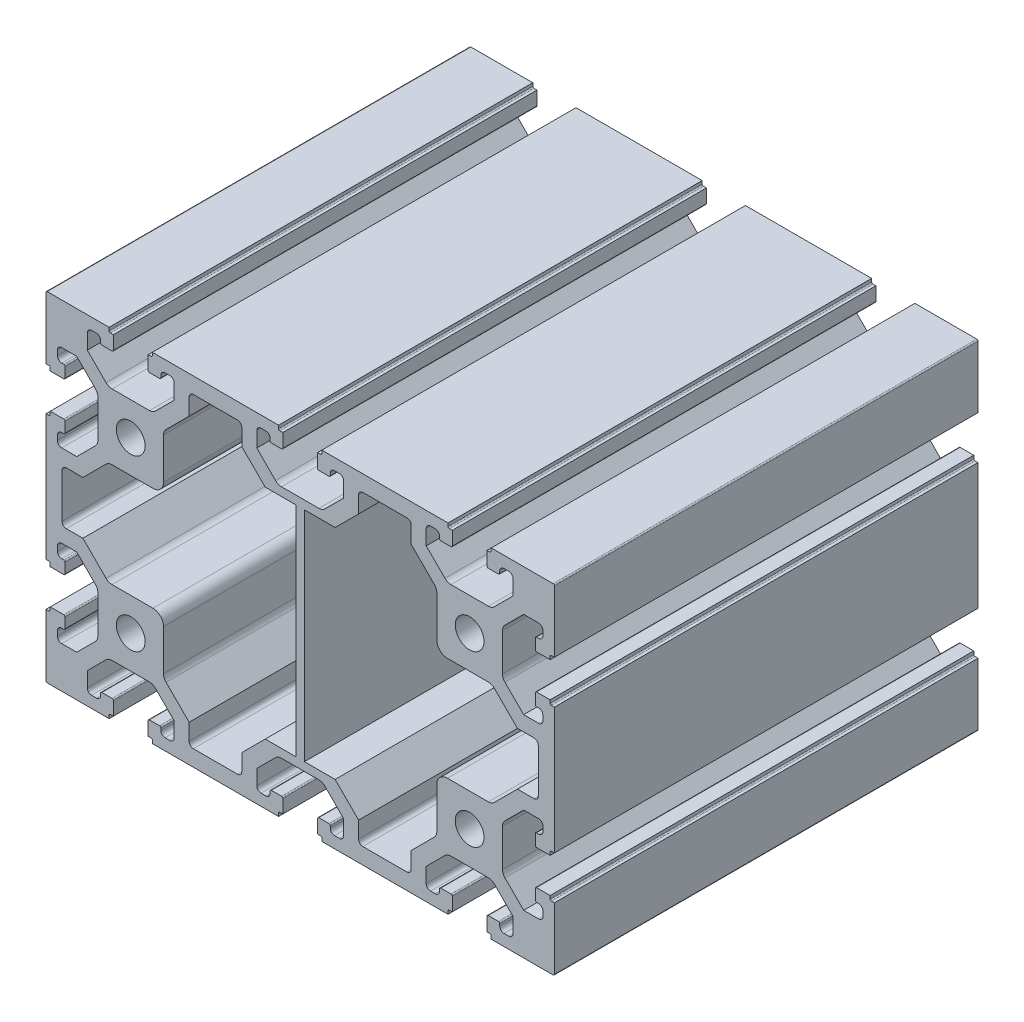
from build123d import *

# Parameters (mm, degrees)
SKETCH_1_R      = 3.4
EXTRUDE_1_DEPTH = 100


with BuildPart() as part:
    # 草图1 → 凸台-拉伸1 (new body)
    with BuildSketch(Plane.XY):
        with BuildLine():
            Line((-45.78942527, 39.655287365), (-60.38942527, 39.655287365))
            ThreePointArc((-60.38942527, 39.655287365), (-60.601557304, 39.567419399), (-60.68942527, 39.355287365))
            Line((-60.68942527, 39.355287365), (-60.68942527, 24.755287365))
            Line((-60.68942527, 24.755287365), (-59.98942527, 24.755287365))
            ThreePointArc((-59.98942527, 24.755287365), (-59.777293236, 24.667419399), (-59.68942527, 24.455287365))
            Line((-59.68942527, 24.455287365), (-59.68942527, 23.755287365))
            Line((-59.68942527, 23.755287365), (-56.48942527, 23.755287365))
            ThreePointArc((-56.48942527, 23.755287365), (-56.277293236, 23.843155331), (-56.18942527, 24.055287365))
            Line((-56.18942527, 24.055287365), (-56.18942527, 26.455287365))
            ThreePointArc((-56.18942527, 26.455287365), (-56.277293236, 26.667419399), (-56.48942527, 26.755287365))
            Line((-56.48942527, 26.755287365), (-56.98942527, 26.755287365))
            ThreePointArc((-56.98942527, 26.755287365), (-57.696532051, 27.048180584), (-57.98942527, 27.755287365))
            Line((-57.98942527, 27.755287365), (-57.98942527, 28.905287365))
            ThreePointArc((-57.98942527, 28.905287365), (-57.696532051, 29.612394146), (-56.98942527, 29.905287365))
            Line((-56.98942527, 29.905287365), (-53.442583275, 29.905287365))
            Line((-53.442583275, 29.905287365), (-49.025211708, 25.487915797))
            ThreePointArc((-49.025211708, 25.487915797), (-48.591666205, 24.8390691), (-48.43942527, 24.073702235))
            Line((-48.43942527, 24.073702235), (-48.43942527, 15.236872495))
            ThreePointArc((-48.43942527, 15.236872495), (-48.591666205, 14.47150563), (-49.025211708, 13.822658933))
            Line((-49.025211708, 13.822658933), (-53.442583275, 9.405287365))
            Line((-53.442583275, 9.405287365), (-56.98942527, 9.405287365))
            ThreePointArc((-56.98942527, 9.405287365), (-57.696532051, 9.698180584), (-57.98942527, 10.405287365))
            Line((-57.98942527, 10.405287365), (-57.98942527, 11.555287365))
            ThreePointArc((-57.98942527, 11.555287365), (-57.696532051, 12.262394146), (-56.98942527, 12.555287365))
            Line((-56.98942527, 12.555287365), (-56.48942527, 12.555287365))
            ThreePointArc((-56.48942527, 12.555287365), (-56.277293236, 12.643155331), (-56.18942527, 12.855287365))
            Line((-56.18942527, 12.855287365), (-56.18942527, 15.255287365))
            ThreePointArc((-56.18942527, 15.255287365), (-56.277293236, 15.467419399), (-56.48942527, 15.555287365))
            Line((-56.48942527, 15.555287365), (-59.68942527, 15.555287365))
            Line((-59.68942527, 15.555287365), (-59.68942527, 14.855287365))
            ThreePointArc((-59.68942527, 14.855287365), (-59.777293236, 14.643155331), (-59.98942527, 14.555287365))
            Line((-59.98942527, 14.555287365), (-60.68942527, 14.555287365))
            Line((-60.68942527, 14.555287365), (-60.68942527, 4.155287365))
            Line((-60.68942527, 4.155287365), (-60.68942527, -4.844712635))
            Line((-60.68942527, -4.844712635), (-60.68942527, -15.244712635))
            Line((-60.68942527, -15.244712635), (-59.98942527, -15.244712635))
            ThreePointArc((-59.98942527, -15.244712635), (-59.777293236, -15.332580601), (-59.68942527, -15.544712635))
            Line((-59.68942527, -15.544712635), (-59.68942527, -16.244712635))
            Line((-59.68942527, -16.244712635), (-56.48942527, -16.244712635))
            ThreePointArc((-56.48942527, -16.244712635), (-56.277293236, -16.156844669), (-56.18942527, -15.944712635))
            Line((-56.18942527, -15.944712635), (-56.18942527, -13.544712635))
            ThreePointArc((-56.18942527, -13.544712635), (-56.277293236, -13.332580601), (-56.48942527, -13.244712635))
            Line((-56.48942527, -13.244712635), (-56.98942527, -13.244712635))
            ThreePointArc((-56.98942527, -13.244712635), (-57.696532051, -12.951819416), (-57.98942527, -12.244712635))
            Line((-57.98942527, -12.244712635), (-57.98942527, -11.094712635))
            ThreePointArc((-57.98942527, -11.094712635), (-57.696532051, -10.387605854), (-56.98942527, -10.094712635))
            Line((-56.98942527, -10.094712635), (-53.442583275, -10.094712635))
            Line((-53.442583275, -10.094712635), (-49.025211708, -14.512084203))
            ThreePointArc((-49.025211708, -14.512084203), (-48.591666205, -15.1609309), (-48.43942527, -15.926297765))
            Line((-48.43942527, -15.926297765), (-48.43942527, -24.763127505))
            ThreePointArc((-48.43942527, -24.763127505), (-48.591666205, -25.52849437), (-49.025211708, -26.177341067))
            Line((-49.025211708, -26.177341067), (-53.442583275, -30.594712635))
            Line((-53.442583275, -30.594712635), (-56.98942527, -30.594712635))
            ThreePointArc((-56.98942527, -30.594712635), (-57.696532051, -30.301819416), (-57.98942527, -29.594712635))
            Line((-57.98942527, -29.594712635), (-57.98942527, -28.444712635))
            ThreePointArc((-57.98942527, -28.444712635), (-57.696532051, -27.737605854), (-56.98942527, -27.444712635))
            Line((-56.98942527, -27.444712635), (-56.48942527, -27.444712635))
            ThreePointArc((-56.48942527, -27.444712635), (-56.277293236, -27.356844669), (-56.18942527, -27.144712635))
            Line((-56.18942527, -27.144712635), (-56.18942527, -24.744712635))
            ThreePointArc((-56.18942527, -24.744712635), (-56.277293236, -24.532580601), (-56.48942527, -24.444712635))
            Line((-56.48942527, -24.444712635), (-59.68942527, -24.444712635))
            Line((-59.68942527, -24.444712635), (-59.68942527, -25.144712635))
            ThreePointArc((-59.68942527, -25.144712635), (-59.777293236, -25.356844669), (-59.98942527, -25.444712635))
            Line((-59.98942527, -25.444712635), (-60.68942527, -25.444712635))
            Line((-60.68942527, -25.444712635), (-60.68942527, -40.044712635))
            ThreePointArc((-60.68942527, -40.044712635), (-60.601557304, -40.256844669), (-60.38942527, -40.344712635))
            Line((-60.38942527, -40.344712635), (-45.78942527, -40.344712635))
            Line((-45.78942527, -40.344712635), (-45.78942527, -39.644712635))
            ThreePointArc((-45.78942527, -39.644712635), (-45.701557304, -39.432580601), (-45.48942527, -39.344712635))
            Line((-45.48942527, -39.344712635), (-44.78942527, -39.344712635))
            Line((-44.78942527, -39.344712635), (-44.78942527, -36.144712635))
            ThreePointArc((-44.78942527, -36.144712635), (-44.877293236, -35.932580601), (-45.08942527, -35.844712635))
            Line((-45.08942527, -35.844712635), (-47.48942527, -35.844712635))
            ThreePointArc((-47.48942527, -35.844712635), (-47.701557304, -35.932580601), (-47.78942527, -36.144712635))
            Line((-47.78942527, -36.144712635), (-47.78942527, -36.644712635))
            ThreePointArc((-47.78942527, -36.644712635), (-48.082318489, -37.351819416), (-48.78942527, -37.644712635))
            Line((-48.78942527, -37.644712635), (-49.93942527, -37.644712635))
            ThreePointArc((-49.93942527, -37.644712635), (-50.646532051, -37.351819416), (-50.93942527, -36.644712635))
            Line((-50.93942527, -36.644712635), (-50.93942527, -33.09787064))
            Line((-50.93942527, -33.09787064), (-46.522053702, -28.680499073))
            ThreePointArc((-46.522053702, -28.680499073), (-45.873207005, -28.24695357), (-45.10784014, -28.094712635))
            Line((-45.10784014, -28.094712635), (-36.2710104, -28.094712635))
            ThreePointArc((-36.2710104, -28.094712635), (-35.505643535, -28.24695357), (-34.856796838, -28.680499073))
            Line((-34.856796838, -28.680499073), (-30.43942527, -33.09787064))
            Line((-30.43942527, -33.09787064), (-30.43942527, -36.644712635))
            ThreePointArc((-30.43942527, -36.644712635), (-30.732318489, -37.351819416), (-31.43942527, -37.644712635))
            Line((-31.43942527, -37.644712635), (-32.58942527, -37.644712635))
            ThreePointArc((-32.58942527, -37.644712635), (-33.296532051, -37.351819416), (-33.58942527, -36.644712635))
            Line((-33.58942527, -36.644712635), (-33.58942527, -36.144712635))
            ThreePointArc((-33.58942527, -36.144712635), (-33.677293236, -35.932580601), (-33.88942527, -35.844712635))
            Line((-33.88942527, -35.844712635), (-36.28942527, -35.844712635))
            ThreePointArc((-36.28942527, -35.844712635), (-36.501557304, -35.932580601), (-36.58942527, -36.144712635))
            Line((-36.58942527, -36.144712635), (-36.58942527, -39.344712635))
            Line((-36.58942527, -39.344712635), (-35.88942527, -39.344712635))
            ThreePointArc((-35.88942527, -39.344712635), (-35.677293236, -39.432580601), (-35.58942527, -39.644712635))
            Line((-35.58942527, -39.644712635), (-35.58942527, -40.344712635))
            Line((-35.58942527, -40.344712635), (-25.18942527, -40.344712635))
            Line((-25.18942527, -40.344712635), (-16.18942527, -40.344712635))
            Line((-16.18942527, -40.344712635), (-5.78942527, -40.344712635))
            Line((-5.78942527, -40.344712635), (-5.78942527, -39.644712635))
            ThreePointArc((-5.78942527, -39.644712635), (-5.701557304, -39.432580601), (-5.48942527, -39.344712635))
            Line((-5.48942527, -39.344712635), (-4.78942527, -39.344712635))
            Line((-4.78942527, -39.344712635), (-4.78942527, -36.144712635))
            ThreePointArc((-4.78942527, -36.144712635), (-4.877293236, -35.932580601), (-5.08942527, -35.844712635))
            Line((-5.08942527, -35.844712635), (-7.48942527, -35.844712635))
            ThreePointArc((-7.48942527, -35.844712635), (-7.701557304, -35.932580601), (-7.78942527, -36.144712635))
            Line((-7.78942527, -36.144712635), (-7.78942527, -36.644712635))
            ThreePointArc((-7.78942527, -36.644712635), (-8.082318489, -37.351819416), (-8.78942527, -37.644712635))
            Line((-8.78942527, -37.644712635), (-9.93942527, -37.644712635))
            ThreePointArc((-9.93942527, -37.644712635), (-10.646532051, -37.351819416), (-10.93942527, -36.644712635))
            Line((-10.93942527, -36.644712635), (-10.93942527, -33.09787064))
            Line((-10.93942527, -33.09787064), (-6.522053702, -28.680499073))
            ThreePointArc((-6.522053702, -28.680499073), (-5.873207005, -28.24695357), (-5.10784014, -28.094712635))
            Line((-5.10784014, -28.094712635), (-0.68942527, -28.094712635))
            Line((-0.68942527, -28.094712635), (3.7289896, -28.094712635))
            ThreePointArc((3.7289896, -28.094712635), (4.494356465, -28.24695357), (5.143203162, -28.680499073))
            Line((5.143203162, -28.680499073), (9.56057473, -33.09787064))
            Line((9.56057473, -33.09787064), (9.56057473, -36.644712635))
            ThreePointArc((9.56057473, -36.644712635), (9.267681511, -37.351819416), (8.56057473, -37.644712635))
            Line((8.56057473, -37.644712635), (7.41057473, -37.644712635))
            ThreePointArc((7.41057473, -37.644712635), (6.703467949, -37.351819416), (6.41057473, -36.644712635))
            Line((6.41057473, -36.644712635), (6.41057473, -36.144712635))
            ThreePointArc((6.41057473, -36.144712635), (6.322706764, -35.932580601), (6.11057473, -35.844712635))
            Line((6.11057473, -35.844712635), (3.71057473, -35.844712635))
            ThreePointArc((3.71057473, -35.844712635), (3.498442696, -35.932580601), (3.41057473, -36.144712635))
            Line((3.41057473, -36.144712635), (3.41057473, -39.344712635))
            Line((3.41057473, -39.344712635), (4.11057473, -39.344712635))
            ThreePointArc((4.11057473, -39.344712635), (4.322706764, -39.432580601), (4.41057473, -39.644712635))
            Line((4.41057473, -39.644712635), (4.41057473, -40.344712635))
            Line((4.41057473, -40.344712635), (14.81057473, -40.344712635))
            Line((14.81057473, -40.344712635), (23.81057473, -40.344712635))
            Line((23.81057473, -40.344712635), (34.21057473, -40.344712635))
            Line((34.21057473, -40.344712635), (34.21057473, -39.644712635))
            ThreePointArc((34.21057473, -39.644712635), (34.298442696, -39.432580601), (34.51057473, -39.344712635))
            Line((34.51057473, -39.344712635), (35.21057473, -39.344712635))
            Line((35.21057473, -39.344712635), (35.21057473, -36.144712635))
            ThreePointArc((35.21057473, -36.144712635), (35.122706764, -35.932580601), (34.91057473, -35.844712635))
            Line((34.91057473, -35.844712635), (32.51057473, -35.844712635))
            ThreePointArc((32.51057473, -35.844712635), (32.298442696, -35.932580601), (32.21057473, -36.144712635))
            Line((32.21057473, -36.144712635), (32.21057473, -36.644712635))
            ThreePointArc((32.21057473, -36.644712635), (31.917681511, -37.351819416), (31.21057473, -37.644712635))
            Line((31.21057473, -37.644712635), (30.06057473, -37.644712635))
            ThreePointArc((30.06057473, -37.644712635), (29.353467949, -37.351819416), (29.06057473, -36.644712635))
            Line((29.06057473, -36.644712635), (29.06057473, -33.09787064))
            Line((29.06057473, -33.09787064), (33.477946298, -28.680499073))
            ThreePointArc((33.477946298, -28.680499073), (34.126792995, -28.24695357), (34.89215986, -28.094712635))
            Line((34.89215986, -28.094712635), (43.7289896, -28.094712635))
            ThreePointArc((43.7289896, -28.094712635), (44.494356465, -28.24695357), (45.143203162, -28.680499073))
            Line((45.143203162, -28.680499073), (49.56057473, -33.09787064))
            Line((49.56057473, -33.09787064), (49.56057473, -36.644712635))
            ThreePointArc((49.56057473, -36.644712635), (49.267681511, -37.351819416), (48.56057473, -37.644712635))
            Line((48.56057473, -37.644712635), (47.41057473, -37.644712635))
            ThreePointArc((47.41057473, -37.644712635), (46.703467949, -37.351819416), (46.41057473, -36.644712635))
            Line((46.41057473, -36.644712635), (46.41057473, -36.144712635))
            ThreePointArc((46.41057473, -36.144712635), (46.322706764, -35.932580601), (46.11057473, -35.844712635))
            Line((46.11057473, -35.844712635), (43.71057473, -35.844712635))
            ThreePointArc((43.71057473, -35.844712635), (43.498442696, -35.932580601), (43.41057473, -36.144712635))
            Line((43.41057473, -36.144712635), (43.41057473, -39.344712635))
            Line((43.41057473, -39.344712635), (44.11057473, -39.344712635))
            ThreePointArc((44.11057473, -39.344712635), (44.322706764, -39.432580601), (44.41057473, -39.644712635))
            Line((44.41057473, -39.644712635), (44.41057473, -40.344712635))
            Line((44.41057473, -40.344712635), (59.01057473, -40.344712635))
            ThreePointArc((59.01057473, -40.344712635), (59.222706764, -40.256844669), (59.31057473, -40.044712635))
            Line((59.31057473, -40.044712635), (59.31057473, -25.444712635))
            Line((59.31057473, -25.444712635), (58.61057473, -25.444712635))
            ThreePointArc((58.61057473, -25.444712635), (58.398442696, -25.356844669), (58.31057473, -25.144712635))
            Line((58.31057473, -25.144712635), (58.31057473, -24.444712635))
            Line((58.31057473, -24.444712635), (55.11057473, -24.444712635))
            ThreePointArc((55.11057473, -24.444712635), (54.898442696, -24.532580601), (54.81057473, -24.744712635))
            Line((54.81057473, -24.744712635), (54.81057473, -27.144712635))
            ThreePointArc((54.81057473, -27.144712635), (54.898442696, -27.356844669), (55.11057473, -27.444712635))
            Line((55.11057473, -27.444712635), (55.61057473, -27.444712635))
            ThreePointArc((55.61057473, -27.444712635), (56.317681511, -27.737605854), (56.61057473, -28.444712635))
            Line((56.61057473, -28.444712635), (56.61057473, -29.594712635))
            ThreePointArc((56.61057473, -29.594712635), (56.317681511, -30.301819416), (55.61057473, -30.594712635))
            Line((55.61057473, -30.594712635), (52.063732735, -30.594712635))
            Line((52.063732735, -30.594712635), (47.646361168, -26.177341067))
            ThreePointArc((47.646361168, -26.177341067), (47.212815665, -25.52849437), (47.06057473, -24.763127505))
            Line((47.06057473, -24.763127505), (47.06057473, -15.926297765))
            ThreePointArc((47.06057473, -15.926297765), (47.212815665, -15.1609309), (47.646361168, -14.512084203))
            Line((47.646361168, -14.512084203), (52.063732735, -10.094712635))
            Line((52.063732735, -10.094712635), (55.61057473, -10.094712635))
            ThreePointArc((55.61057473, -10.094712635), (56.317681511, -10.387605854), (56.61057473, -11.094712635))
            Line((56.61057473, -11.094712635), (56.61057473, -12.244712635))
            ThreePointArc((56.61057473, -12.244712635), (56.317681511, -12.951819416), (55.61057473, -13.244712635))
            Line((55.61057473, -13.244712635), (55.11057473, -13.244712635))
            ThreePointArc((55.11057473, -13.244712635), (54.898442696, -13.332580601), (54.81057473, -13.544712635))
            Line((54.81057473, -13.544712635), (54.81057473, -15.944712635))
            ThreePointArc((54.81057473, -15.944712635), (54.898442696, -16.156844669), (55.11057473, -16.244712635))
            Line((55.11057473, -16.244712635), (58.31057473, -16.244712635))
            Line((58.31057473, -16.244712635), (58.31057473, -15.544712635))
            ThreePointArc((58.31057473, -15.544712635), (58.398442696, -15.332580601), (58.61057473, -15.244712635))
            Line((58.61057473, -15.244712635), (59.31057473, -15.244712635))
            Line((59.31057473, -15.244712635), (59.31057473, -4.844712635))
            Line((59.31057473, -4.844712635), (59.31057473, 4.155287365))
            Line((59.31057473, 4.155287365), (59.31057473, 14.555287365))
            Line((59.31057473, 14.555287365), (58.61057473, 14.555287365))
            ThreePointArc((58.61057473, 14.555287365), (58.398442696, 14.643155331), (58.31057473, 14.855287365))
            Line((58.31057473, 14.855287365), (58.31057473, 15.555287365))
            Line((58.31057473, 15.555287365), (55.11057473, 15.555287365))
            ThreePointArc((55.11057473, 15.555287365), (54.898442696, 15.467419399), (54.81057473, 15.255287365))
            Line((54.81057473, 15.255287365), (54.81057473, 12.855287365))
            ThreePointArc((54.81057473, 12.855287365), (54.898442696, 12.643155331), (55.11057473, 12.555287365))
            Line((55.11057473, 12.555287365), (55.61057473, 12.555287365))
            ThreePointArc((55.61057473, 12.555287365), (56.317681511, 12.262394146), (56.61057473, 11.555287365))
            Line((56.61057473, 11.555287365), (56.61057473, 10.405287365))
            ThreePointArc((56.61057473, 10.405287365), (56.317681511, 9.698180584), (55.61057473, 9.405287365))
            Line((55.61057473, 9.405287365), (52.063732735, 9.405287365))
            Line((52.063732735, 9.405287365), (47.646361168, 13.822658933))
            ThreePointArc((47.646361168, 13.822658933), (47.212815665, 14.47150563), (47.06057473, 15.236872495))
            Line((47.06057473, 15.236872495), (47.06057473, 24.073702235))
            ThreePointArc((47.06057473, 24.073702235), (47.212815665, 24.8390691), (47.646361168, 25.487915797))
            Line((47.646361168, 25.487915797), (52.063732735, 29.905287365))
            Line((52.063732735, 29.905287365), (55.61057473, 29.905287365))
            ThreePointArc((55.61057473, 29.905287365), (56.317681511, 29.612394146), (56.61057473, 28.905287365))
            Line((56.61057473, 28.905287365), (56.61057473, 27.755287365))
            ThreePointArc((56.61057473, 27.755287365), (56.317681511, 27.048180584), (55.61057473, 26.755287365))
            Line((55.61057473, 26.755287365), (55.11057473, 26.755287365))
            ThreePointArc((55.11057473, 26.755287365), (54.898442696, 26.667419399), (54.81057473, 26.455287365))
            Line((54.81057473, 26.455287365), (54.81057473, 24.055287365))
            ThreePointArc((54.81057473, 24.055287365), (54.898442696, 23.843155331), (55.11057473, 23.755287365))
            Line((55.11057473, 23.755287365), (58.31057473, 23.755287365))
            Line((58.31057473, 23.755287365), (58.31057473, 24.455287365))
            ThreePointArc((58.31057473, 24.455287365), (58.398442696, 24.667419399), (58.61057473, 24.755287365))
            Line((58.61057473, 24.755287365), (59.31057473, 24.755287365))
            Line((59.31057473, 24.755287365), (59.31057473, 39.355287365))
            ThreePointArc((59.31057473, 39.355287365), (59.222706764, 39.567419399), (59.01057473, 39.655287365))
            Line((59.01057473, 39.655287365), (44.41057473, 39.655287365))
            Line((44.41057473, 39.655287365), (44.41057473, 38.955287365))
            ThreePointArc((44.41057473, 38.955287365), (44.322706764, 38.743155331), (44.11057473, 38.655287365))
            Line((44.11057473, 38.655287365), (43.41057473, 38.655287365))
            Line((43.41057473, 38.655287365), (43.41057473, 35.455287365))
            ThreePointArc((43.41057473, 35.455287365), (43.498442696, 35.243155331), (43.71057473, 35.155287365))
            Line((43.71057473, 35.155287365), (46.11057473, 35.155287365))
            ThreePointArc((46.11057473, 35.155287365), (46.322706764, 35.243155331), (46.41057473, 35.455287365))
            Line((46.41057473, 35.455287365), (46.41057473, 35.955287365))
            ThreePointArc((46.41057473, 35.955287365), (46.703467949, 36.662394146), (47.41057473, 36.955287365))
            Line((47.41057473, 36.955287365), (48.56057473, 36.955287365))
            ThreePointArc((48.56057473, 36.955287365), (49.267681511, 36.662394146), (49.56057473, 35.955287365))
            Line((49.56057473, 35.955287365), (49.56057473, 32.40844537))
            Line((49.56057473, 32.40844537), (45.143203162, 27.991073803))
            ThreePointArc((45.143203162, 27.991073803), (44.494356465, 27.5575283), (43.7289896, 27.405287365))
            Line((43.7289896, 27.405287365), (34.89215986, 27.405287365))
            ThreePointArc((34.89215986, 27.405287365), (34.126792995, 27.5575283), (33.477946298, 27.991073803))
            Line((33.477946298, 27.991073803), (29.06057473, 32.40844537))
            Line((29.06057473, 32.40844537), (29.06057473, 35.955287365))
            ThreePointArc((29.06057473, 35.955287365), (29.353467949, 36.662394146), (30.06057473, 36.955287365))
            Line((30.06057473, 36.955287365), (31.21057473, 36.955287365))
            ThreePointArc((31.21057473, 36.955287365), (31.917681511, 36.662394146), (32.21057473, 35.955287365))
            Line((32.21057473, 35.955287365), (32.21057473, 35.455287365))
            ThreePointArc((32.21057473, 35.455287365), (32.298442696, 35.243155331), (32.51057473, 35.155287365))
            Line((32.51057473, 35.155287365), (34.91057473, 35.155287365))
            ThreePointArc((34.91057473, 35.155287365), (35.122706764, 35.243155331), (35.21057473, 35.455287365))
            Line((35.21057473, 35.455287365), (35.21057473, 38.655287365))
            Line((35.21057473, 38.655287365), (34.51057473, 38.655287365))
            ThreePointArc((34.51057473, 38.655287365), (34.298442696, 38.743155331), (34.21057473, 38.955287365))
            Line((34.21057473, 38.955287365), (34.21057473, 39.655287365))
            Line((34.21057473, 39.655287365), (23.81057473, 39.655287365))
            Line((23.81057473, 39.655287365), (14.81057473, 39.655287365))
            Line((14.81057473, 39.655287365), (4.41057473, 39.655287365))
            Line((4.41057473, 39.655287365), (4.41057473, 38.955287365))
            ThreePointArc((4.41057473, 38.955287365), (4.322706764, 38.743155331), (4.11057473, 38.655287365))
            Line((4.11057473, 38.655287365), (3.41057473, 38.655287365))
            Line((3.41057473, 38.655287365), (3.41057473, 35.455287365))
            ThreePointArc((3.41057473, 35.455287365), (3.498442696, 35.243155331), (3.71057473, 35.155287365))
            Line((3.71057473, 35.155287365), (6.11057473, 35.155287365))
            ThreePointArc((6.11057473, 35.155287365), (6.322706764, 35.243155331), (6.41057473, 35.455287365))
            Line((6.41057473, 35.455287365), (6.41057473, 35.955287365))
            ThreePointArc((6.41057473, 35.955287365), (6.703467949, 36.662394146), (7.41057473, 36.955287365))
            Line((7.41057473, 36.955287365), (8.56057473, 36.955287365))
            ThreePointArc((8.56057473, 36.955287365), (9.267681511, 36.662394146), (9.56057473, 35.955287365))
            Line((9.56057473, 35.955287365), (9.56057473, 32.40844537))
            Line((9.56057473, 32.40844537), (5.143203162, 27.991073803))
            ThreePointArc((5.143203162, 27.991073803), (4.494356465, 27.5575283), (3.7289896, 27.405287365))
            Line((3.7289896, 27.405287365), (-0.68942527, 27.405287365))
            Line((-0.68942527, 27.405287365), (-5.10784014, 27.405287365))
            ThreePointArc((-5.10784014, 27.405287365), (-5.873207005, 27.5575283), (-6.522053702, 27.991073803))
            Line((-6.522053702, 27.991073803), (-10.93942527, 32.40844537))
            Line((-10.93942527, 32.40844537), (-10.93942527, 35.955287365))
            ThreePointArc((-10.93942527, 35.955287365), (-10.646532051, 36.662394146), (-9.93942527, 36.955287365))
            Line((-9.93942527, 36.955287365), (-8.78942527, 36.955287365))
            ThreePointArc((-8.78942527, 36.955287365), (-8.082318489, 36.662394146), (-7.78942527, 35.955287365))
            Line((-7.78942527, 35.955287365), (-7.78942527, 35.455287365))
            ThreePointArc((-7.78942527, 35.455287365), (-7.701557304, 35.243155331), (-7.48942527, 35.155287365))
            Line((-7.48942527, 35.155287365), (-5.08942527, 35.155287365))
            ThreePointArc((-5.08942527, 35.155287365), (-4.877293236, 35.243155331), (-4.78942527, 35.455287365))
            Line((-4.78942527, 35.455287365), (-4.78942527, 38.655287365))
            Line((-4.78942527, 38.655287365), (-5.48942527, 38.655287365))
            ThreePointArc((-5.48942527, 38.655287365), (-5.701557304, 38.743155331), (-5.78942527, 38.955287365))
            Line((-5.78942527, 38.955287365), (-5.78942527, 39.655287365))
            Line((-5.78942527, 39.655287365), (-16.18942527, 39.655287365))
            Line((-16.18942527, 39.655287365), (-25.18942527, 39.655287365))
            Line((-25.18942527, 39.655287365), (-35.58942527, 39.655287365))
            Line((-35.58942527, 39.655287365), (-35.58942527, 38.955287365))
            ThreePointArc((-35.58942527, 38.955287365), (-35.677293236, 38.743155331), (-35.88942527, 38.655287365))
            Line((-35.88942527, 38.655287365), (-36.58942527, 38.655287365))
            Line((-36.58942527, 38.655287365), (-36.58942527, 35.455287365))
            ThreePointArc((-36.58942527, 35.455287365), (-36.501557304, 35.243155331), (-36.28942527, 35.155287365))
            Line((-36.28942527, 35.155287365), (-33.88942527, 35.155287365))
            ThreePointArc((-33.88942527, 35.155287365), (-33.677293236, 35.243155331), (-33.58942527, 35.455287365))
            Line((-33.58942527, 35.455287365), (-33.58942527, 35.955287365))
            ThreePointArc((-33.58942527, 35.955287365), (-33.296532051, 36.662394146), (-32.58942527, 36.955287365))
            Line((-32.58942527, 36.955287365), (-31.43942527, 36.955287365))
            ThreePointArc((-31.43942527, 36.955287365), (-30.732318489, 36.662394146), (-30.43942527, 35.955287365))
            Line((-30.43942527, 35.955287365), (-30.43942527, 32.40844537))
            Line((-30.43942527, 32.40844537), (-34.856796838, 27.991073803))
            ThreePointArc((-34.856796838, 27.991073803), (-35.505643535, 27.5575283), (-36.2710104, 27.405287365))
            Line((-36.2710104, 27.405287365), (-45.10784014, 27.405287365))
            ThreePointArc((-45.10784014, 27.405287365), (-45.873207005, 27.5575283), (-46.522053702, 27.991073803))
            Line((-46.522053702, 27.991073803), (-50.93942527, 32.40844537))
            Line((-50.93942527, 32.40844537), (-50.93942527, 35.955287365))
            ThreePointArc((-50.93942527, 35.955287365), (-50.646532051, 36.662394146), (-49.93942527, 36.955287365))
            Line((-49.93942527, 36.955287365), (-48.78942527, 36.955287365))
            ThreePointArc((-48.78942527, 36.955287365), (-48.082318489, 36.662394146), (-47.78942527, 35.955287365))
            Line((-47.78942527, 35.955287365), (-47.78942527, 35.455287365))
            ThreePointArc((-47.78942527, 35.455287365), (-47.701557304, 35.243155331), (-47.48942527, 35.155287365))
            Line((-47.48942527, 35.155287365), (-45.08942527, 35.155287365))
            ThreePointArc((-45.08942527, 35.155287365), (-44.877293236, 35.243155331), (-44.78942527, 35.455287365))
            Line((-44.78942527, 35.455287365), (-44.78942527, 38.655287365))
            Line((-44.78942527, 38.655287365), (-45.48942527, 38.655287365))
            ThreePointArc((-45.48942527, 38.655287365), (-45.701557304, 38.743155331), (-45.78942527, 38.955287365))
            Line((-45.78942527, 38.955287365), (-45.78942527, 39.655287365))
        make_face()
        with Locations((-40.68942527, 19.655287365)):
            Circle(SKETCH_1_R, mode=Mode.SUBTRACT)
        with Locations((-40.68942527, -20.344712635)):
            Circle(SKETCH_1_R, mode=Mode.SUBTRACT)
        with Locations((39.31057473, 19.655287365)):
            Circle(SKETCH_1_R, mode=Mode.SUBTRACT)
        with Locations((39.31057473, -20.344712635)):
            Circle(SKETCH_1_R, mode=Mode.SUBTRACT)
        with BuildLine():
            Line((-51.976267265, 5.865287365), (-46.522053702, 11.319500927))
            ThreePointArc((-46.522053702, 11.319500927), (-45.873207005, 11.75304643), (-45.10784014, 11.905287365))
            Line((-45.10784014, 11.905287365), (-35.43942527, 11.905287365))
            ThreePointArc((-35.43942527, 11.905287365), (-33.671658317, 12.637520412), (-32.93942527, 14.405287365))
            Line((-32.93942527, 14.405287365), (-32.93942527, 24.073702235))
            ThreePointArc((-32.93942527, 24.073702235), (-32.787184335, 24.8390691), (-32.353638832, 25.487915797))
            Line((-32.353638832, 25.487915797), (-26.89942527, 30.94212936))
            Line((-26.89942527, 30.94212936), (-26.89942527, 34.855287365))
            ThreePointArc((-26.89942527, 34.855287365), (-26.606532051, 35.562394146), (-25.89942527, 35.855287365))
            Line((-25.89942527, 35.855287365), (-15.47942527, 35.855287365))
            ThreePointArc((-15.47942527, 35.855287365), (-14.772318489, 35.562394146), (-14.47942527, 34.855287365))
            Line((-14.47942527, 34.855287365), (-14.47942527, 30.94212936))
            Line((-14.47942527, 30.94212936), (-8.942583275, 25.405287365))
            Line((-8.942583275, 25.405287365), (-1.68942527, 25.405287365))
            Line((-1.68942527, 25.405287365), (-1.68942527, -26.094712635))
            Line((-1.68942527, -26.094712635), (-8.942583275, -26.094712635))
            Line((-8.942583275, -26.094712635), (-14.47942527, -31.63155463))
            Line((-14.47942527, -31.63155463), (-14.47942527, -35.544712635))
            ThreePointArc((-14.47942527, -35.544712635), (-14.772318489, -36.251819416), (-15.47942527, -36.544712635))
            Line((-15.47942527, -36.544712635), (-25.89942527, -36.544712635))
            ThreePointArc((-25.89942527, -36.544712635), (-26.606532051, -36.251819416), (-26.89942527, -35.544712635))
            Line((-26.89942527, -35.544712635), (-26.89942527, -31.63155463))
            Line((-26.89942527, -31.63155463), (-32.353638832, -26.177341067))
            ThreePointArc((-32.353638832, -26.177341067), (-32.787184335, -25.52849437), (-32.93942527, -24.763127505))
            Line((-32.93942527, -24.763127505), (-32.93942527, -15.094712635))
            ThreePointArc((-32.93942527, -15.094712635), (-33.671658317, -13.326945682), (-35.43942527, -12.594712635))
            Line((-35.43942527, -12.594712635), (-45.10784014, -12.594712635))
            ThreePointArc((-45.10784014, -12.594712635), (-45.873207005, -12.4424717), (-46.522053702, -12.008926197))
            Line((-46.522053702, -12.008926197), (-51.976267265, -6.554712635))
            Line((-51.976267265, -6.554712635), (-55.88942527, -6.554712635))
            ThreePointArc((-55.88942527, -6.554712635), (-56.596532051, -6.261819416), (-56.88942527, -5.554712635))
            Line((-56.88942527, -5.554712635), (-56.88942527, 4.865287365))
            ThreePointArc((-56.88942527, 4.865287365), (-56.596532051, 5.572394146), (-55.88942527, 5.865287365))
            Line((-55.88942527, 5.865287365), (-51.976267265, 5.865287365))
        make_face(mode=Mode.SUBTRACT)
        with BuildLine():
            Line((50.597416725, 5.865287365), (45.143203162, 11.319500927))
            ThreePointArc((45.143203162, 11.319500927), (44.494356465, 11.75304643), (43.7289896, 11.905287365))
            Line((43.7289896, 11.905287365), (34.06057473, 11.905287365))
            ThreePointArc((34.06057473, 11.905287365), (32.292807777, 12.637520412), (31.56057473, 14.405287365))
            Line((31.56057473, 14.405287365), (31.56057473, 24.073702235))
            ThreePointArc((31.56057473, 24.073702235), (31.408333795, 24.8390691), (30.974788292, 25.487915797))
            Line((30.974788292, 25.487915797), (25.52057473, 30.94212936))
            Line((25.52057473, 30.94212936), (25.52057473, 34.855287365))
            ThreePointArc((25.52057473, 34.855287365), (25.227681511, 35.562394146), (24.52057473, 35.855287365))
            Line((24.52057473, 35.855287365), (14.10057473, 35.855287365))
            ThreePointArc((14.10057473, 35.855287365), (13.393467949, 35.562394146), (13.10057473, 34.855287365))
            Line((13.10057473, 34.855287365), (13.10057473, 30.94212936))
            Line((13.10057473, 30.94212936), (7.563732735, 25.405287365))
            Line((7.563732735, 25.405287365), (0.31057473, 25.405287365))
            Line((0.31057473, 25.405287365), (0.31057473, -26.094712635))
            Line((0.31057473, -26.094712635), (7.563732735, -26.094712635))
            Line((7.563732735, -26.094712635), (13.10057473, -31.63155463))
            Line((13.10057473, -31.63155463), (13.10057473, -35.544712635))
            ThreePointArc((13.10057473, -35.544712635), (13.393467949, -36.251819416), (14.10057473, -36.544712635))
            Line((14.10057473, -36.544712635), (24.52057473, -36.544712635))
            ThreePointArc((24.52057473, -36.544712635), (25.227681511, -36.251819416), (25.52057473, -35.544712635))
            Line((25.52057473, -35.544712635), (25.52057473, -31.63155463))
            Line((25.52057473, -31.63155463), (30.974788292, -26.177341067))
            ThreePointArc((30.974788292, -26.177341067), (31.408333795, -25.52849437), (31.56057473, -24.763127505))
            Line((31.56057473, -24.763127505), (31.56057473, -15.094712635))
            ThreePointArc((31.56057473, -15.094712635), (32.292807777, -13.326945682), (34.06057473, -12.594712635))
            Line((34.06057473, -12.594712635), (43.7289896, -12.594712635))
            ThreePointArc((43.7289896, -12.594712635), (44.494356465, -12.4424717), (45.143203162, -12.008926197))
            Line((45.143203162, -12.008926197), (50.597416725, -6.554712635))
            Line((50.597416725, -6.554712635), (54.51057473, -6.554712635))
            ThreePointArc((54.51057473, -6.554712635), (55.217681511, -6.261819416), (55.51057473, -5.554712635))
            Line((55.51057473, -5.554712635), (55.51057473, 4.865287365))
            ThreePointArc((55.51057473, 4.865287365), (55.217681511, 5.572394146), (54.51057473, 5.865287365))
            Line((54.51057473, 5.865287365), (50.597416725, 5.865287365))
        make_face(mode=Mode.SUBTRACT)
    extrude(amount=EXTRUDE_1_DEPTH)


solid = part.part
